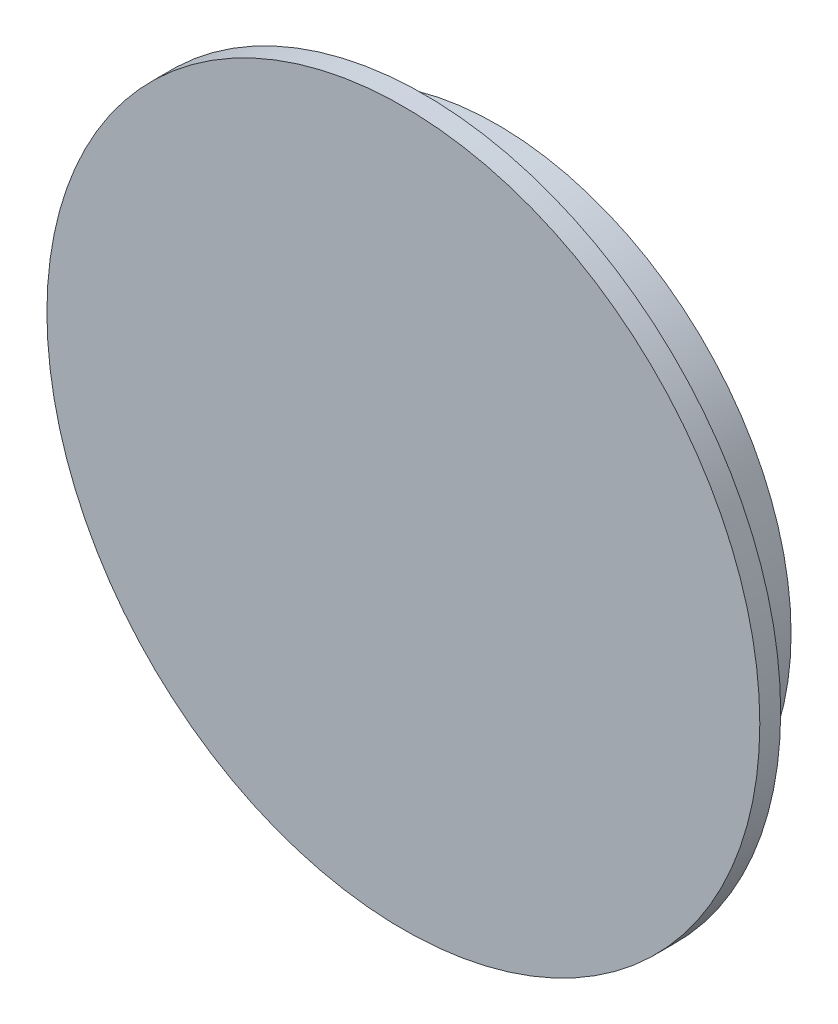
from build123d import *

# Parameters (mm, degrees)
SKETCH1_R           = 14.1
SKETCH1_R_2         = 12.6
BOSS_EXTRUDE1_DEPTH = 3.5
SKETCH2_R           = 17.1
SKETCH2_R_2         = 14.1
SKETCH2_R_3         = 12.6
BOSS_EXTRUDE2_DEPTH = 1


with BuildPart() as part:
    # Sketch1 → Boss-Extrude1 (new body)
    with BuildSketch(Plane.XY):
        Circle(SKETCH1_R)
        Circle(SKETCH1_R_2, mode=Mode.SUBTRACT)
    extrude(amount=BOSS_EXTRUDE1_DEPTH)

    # Sketch2 → Boss-Extrude2 (add)
    # profile 1 of 3: a face of its own
    with BuildSketch(Plane.XY.offset(3.5)):
        Circle(SKETCH2_R)
        Circle(SKETCH2_R_2, mode=Mode.SUBTRACT)
    # profile 2 of 3: a face of its own
    with BuildSketch(Plane.XY.offset(3.5)):
        Circle(SKETCH2_R_2)
        Circle(SKETCH2_R_3, mode=Mode.SUBTRACT)
    # profile 3 of 3: a face of its own
    with BuildSketch(Plane.XY.offset(3.5)):
        Circle(SKETCH2_R_3)
    extrude(amount=BOSS_EXTRUDE2_DEPTH)


solid = part.part
